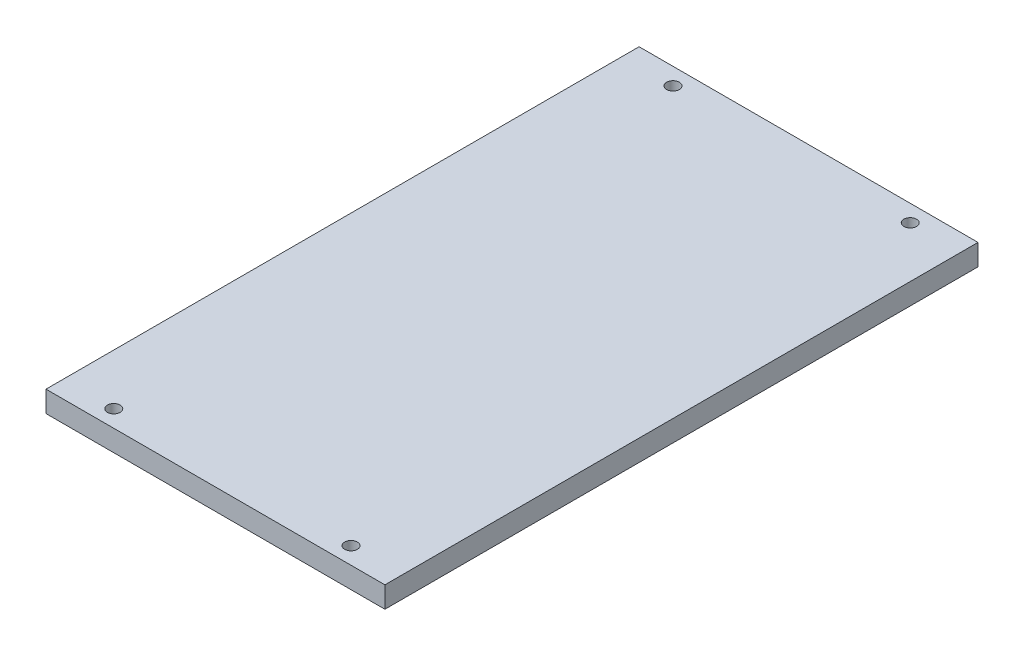
from build123d import *

# Parameters (mm, degrees)
SKETCH1_W           = 80
SKETCH1_H           = 140
BOSS_EXTRUDE1_DEPTH = 5
SKETCH2_R           = 1.5
CUT_EXTRUDE1_DEPTH  = 162.322658049
SKETCH3_R           = 1.5
CUT_EXTRUDE2_DEPTH  = 162.322658049


with BuildPart() as part:
    # Sketch1 → Boss-Extrude1 (new body)
    with BuildSketch(Plane(origin=(0, 0, 0), x_dir=(1, 0, 0), z_dir=(0, 1, 0))):
        with Locations((-40, 70)):
            Rectangle(SKETCH1_W, SKETCH1_H)
    extrude(amount=BOSS_EXTRUDE1_DEPTH)

    # Sketch2 → Cut-Extrude1 (cut, through all)
    with BuildSketch(Plane(origin=(0, 5, 0), x_dir=(1, 0, 0), z_dir=(0, 1, 0))):
        with Locations(Location((-68, 136, 0), (0, 0, 270))):
            Circle(SKETCH2_R)
    cut_extrude1 = extrude(amount=-CUT_EXTRUDE1_DEPTH, mode=Mode.SUBTRACT)

    # Sketch3 → Cut-Extrude2 (cut, through all)
    with BuildSketch(Plane(origin=(0, 5, 0), x_dir=(1, 0, 0), z_dir=(0, 1, 0))):
        with Locations(Location((-12, 136, 0), (0, 0, 270))):
            Circle(SKETCH3_R)
    cut_extrude2 = extrude(amount=-CUT_EXTRUDE2_DEPTH, mode=Mode.SUBTRACT)

    # Mirror1: Cut-Extrude1, Cut-Extrude2 across plane
    add(cut_extrude1.mirror(Plane.XY.offset(-70)), mode=Mode.SUBTRACT)
    add(cut_extrude2.mirror(Plane.XY.offset(-70)), mode=Mode.SUBTRACT)


solid = part.part
